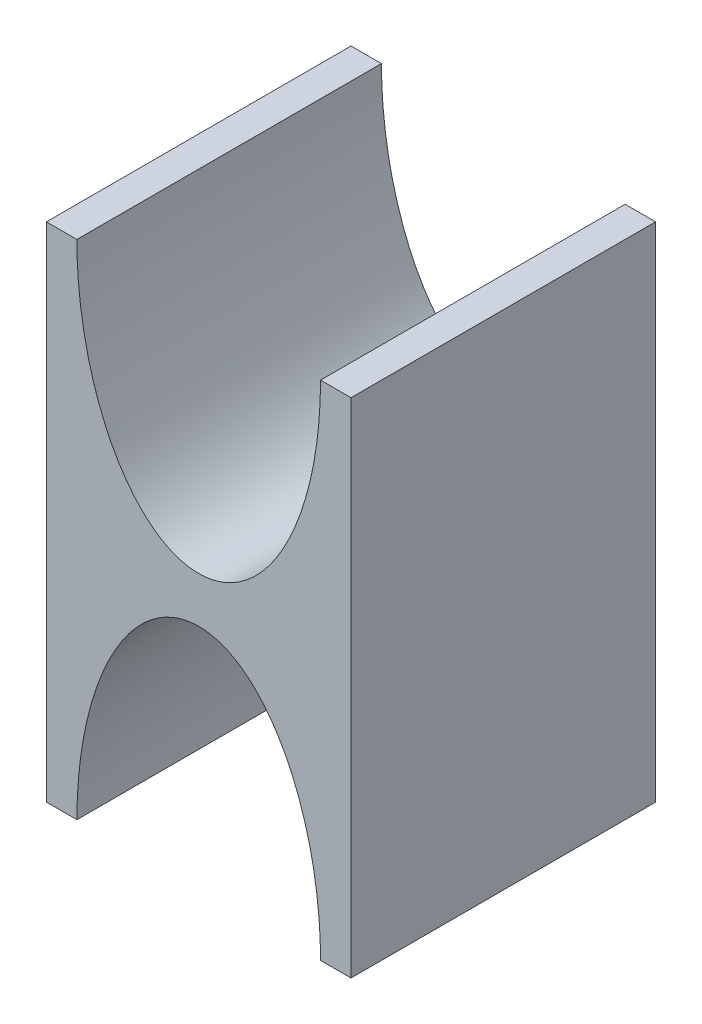
from build123d import *

# Parameters (mm, degrees)
BOSS_EXTRUDE1_DEPTH = 20


with BuildPart() as part:
    # Sketch1 → Boss-Extrude1 (new body)
    with BuildSketch(Plane.XY):
        with BuildLine():
            Line((-8, 16.5), (-10, 16.5))
            Line((-10, 16.5), (-10, -16.5))
            Line((-10, -16.5), (-8, -16.5))
            add(Edge.make_bspline(
                [(8, -16.5), (8, -1.5), (0, -1.5), (-8, -1.5), (-8, -16.5)],
                knots=[4.71238898, 4.71238898, 4.71238898, 6.283185307, 6.283185307, 7.853981634, 7.853981634, 7.853981634], degree=2, weights=[1, 0.707106781, 1, 0.707106781, 1]))
            Line((8, -16.5), (10, -16.5))
            Line((10, -16.5), (10, 16.5))
            Line((10, 16.5), (8, 16.5))
            add(Edge.make_bspline(
                [(-8, 16.5), (-8, 1.5), (0, 1.5), (8, 1.5), (8, 16.5)],
                knots=[4.71238898, 4.71238898, 4.71238898, 6.283185307, 6.283185307, 7.853981634, 7.853981634, 7.853981634], degree=2, weights=[1, 0.707106781, 1, 0.707106781, 1]))
        make_face()
    extrude(amount=BOSS_EXTRUDE1_DEPTH)


solid = part.part
